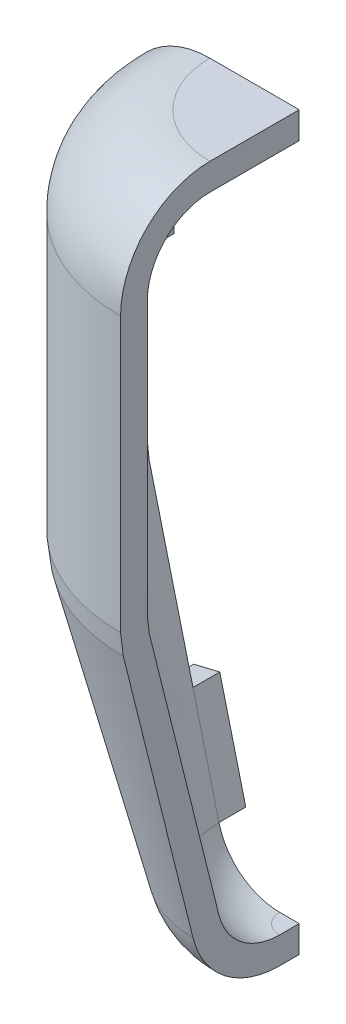
from build123d import *

# Parameters (mm, degrees)
REVOLVE2_ANGLE      = 90
SKETCH3_W           = 3
SKETCH3_H           = 12
BOSS_EXTRUDE1_DEPTH = 3


with BuildPart() as part:
    # Sketch1 → Revolve2 (revolve)
    with BuildSketch(Plane.XY):
        with BuildLine():
            Line((-55.793660937, -33.37535625), (-63.601425001, -2.144299994))
            Line((-63.601425001, -2.144299994), (-63.9, 0.281056256))
            Line((-63.9, 0.281056256), (-63.9, 30.95))
            ThreePointArc((-63.9, 30.95), (-60.971067812, 38.021067812), (-53.9, 40.95))
            Line((-53.9, 40.95), (-43.9, 40.95))
            Line((-43.9, 40.95), (-43.9, 37.95))
            Line((-43.9, 37.95), (-53.9, 37.95))
            ThreePointArc((-53.9, 37.95), (-58.849747468, 35.899747468), (-60.9, 30.95))
            Line((-60.9, 30.95), (-60.9, 0.281056256))
            Line((-60.9, 0.281056256), (-60.690997501, -1.416693119))
            Line((-60.690997501, -1.416693119), (-55.793660937, -21.006039374))
            Line((-55.793660937, -21.006039374), (-52.883233437, -32.647749375))
            ThreePointArc((-52.883233437, -32.647749375), (-50.400121402, -36.467438066), (-46.092235936, -37.95))
            Line((-46.092235936, -37.95), (-43.9, -37.95))
            Line((-43.9, -37.95), (-43.9, -40.95))
            Line((-43.9, -40.95), (-46.092235936, -40.95))
            ThreePointArc((-46.092235936, -40.95), (-52.24635803, -38.83205438), (-55.793660937, -33.37535625))
        make_face()
    revolve(axis=Axis((-43.9, 40.95, 0), (0, 1, 0)), revolution_arc=REVOLVE2_ANGLE)

    # Sketch3 → Boss-Extrude1 (add)
    with BuildSketch(Plane(origin=(0, 0, 0), x_dir=(-1, 0, 0), z_dir=(0, 0, -1))):
        Polygon((55.793660937, -33.37535625), (58.711666985, -21.70333206), (55.793660937, -21.006039374), (52.883233437, -32.647749375), align=None)
        with Locations((62.4, 24.95)):
            Rectangle(SKETCH3_W, SKETCH3_H)
    extrude(amount=BOSS_EXTRUDE1_DEPTH)


solid = part.part
